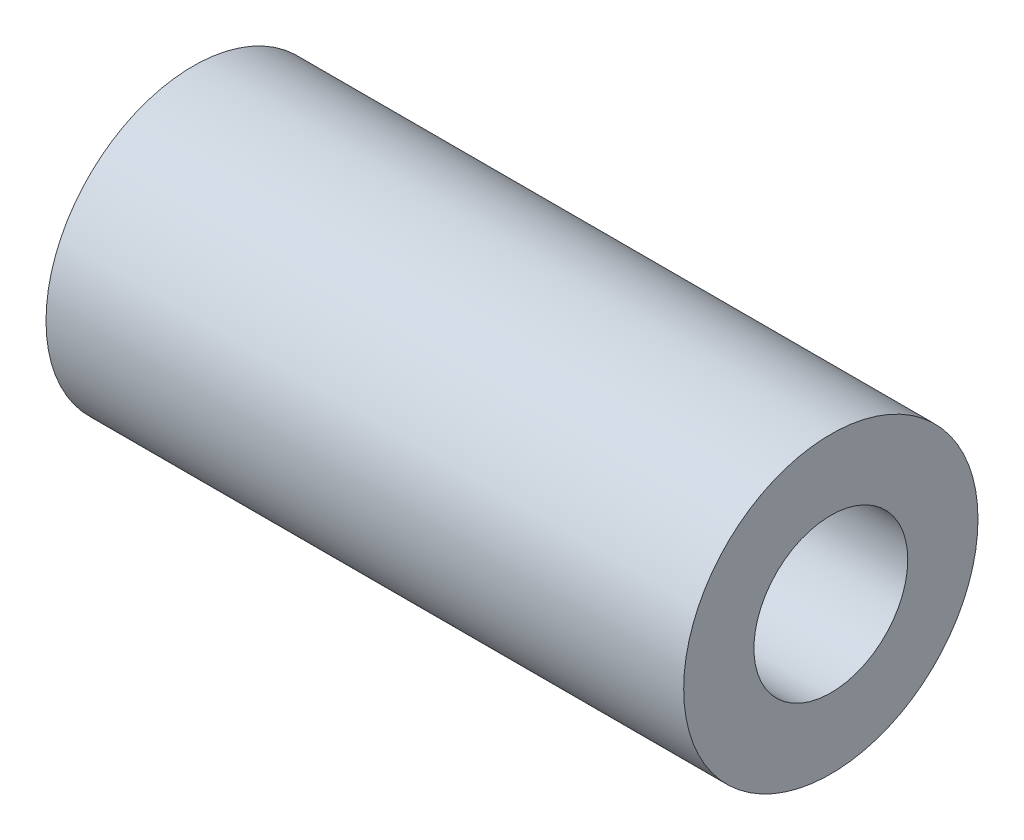
from build123d import *

# Parameters (mm, degrees)
SKETCH1_R           = 4.7625
SKETCH1_R_2         = 2.4892
BOSS_EXTRUDE1_DEPTH = 10.31875


with BuildPart() as part:
    # Sketch1 → Boss-Extrude1 (new, symmetric)
    with BuildSketch(Plane(origin=(0, 0, 0), x_dir=(0, 0, -1), z_dir=(1, 0, 0))):
        Circle(SKETCH1_R)
        Circle(SKETCH1_R_2, mode=Mode.SUBTRACT)
    extrude(amount=BOSS_EXTRUDE1_DEPTH, both=True)


solid = part.part
